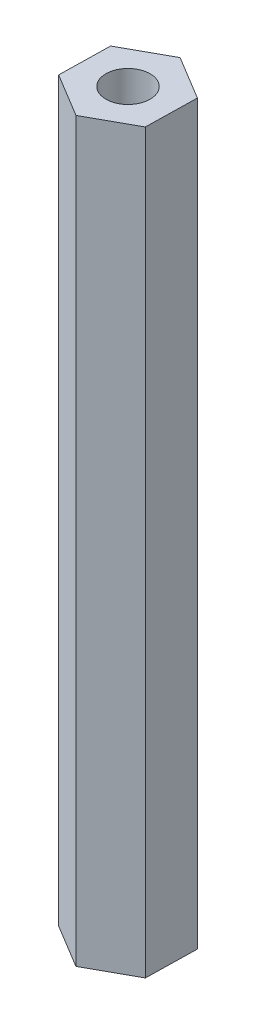
from build123d import *

# Parameters (mm, degrees)
SKETCH_1_R      = 1.5
EXTRUDE_1_DEPTH = 50


with BuildPart() as part:
    # 草图1 → 凸台-拉伸1 (new body)
    with BuildSketch(Plane(origin=(0, 0, 0), x_dir=(1, 0, 0), z_dir=(0, 1, 0))):
        Polygon((2.96592106, -1.78977995), (3.032955433, 1.673673008), (0.067034374, 3.463452958), (-2.96592106, 1.78977995), (-3.032955433, -1.673673008), (-0.067034374, -3.463452958), align=None)
        with Locations(Location((0, 0, 0), (0, 0, 270))):
            Circle(SKETCH_1_R, mode=Mode.SUBTRACT)
    extrude(amount=EXTRUDE_1_DEPTH)


solid = part.part
